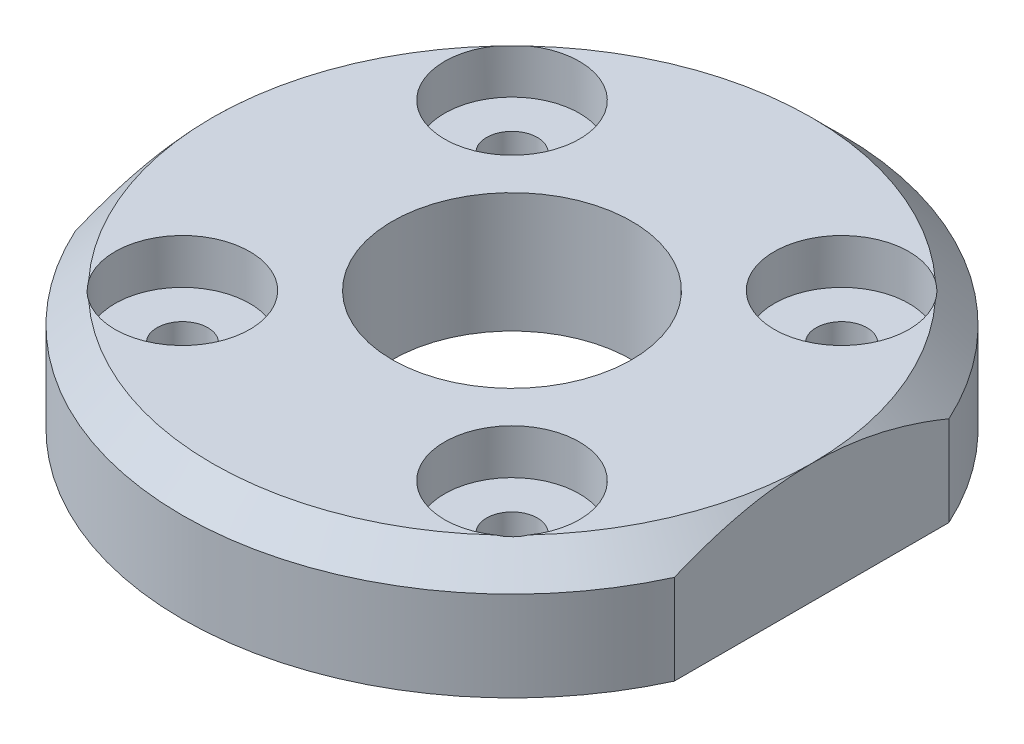
from build123d import *

# Parameters (mm, degrees)
SKETCH1_R                               = 22
SKETCH1_R_2                             = 8
EXTRUDE1_DEPTH                          = 8
CHAMFER1_SIZE                           = 2
CBORE_FOR_M3_HEX_HEAD_BOLT1_D           = 3.4
CBORE_FOR_M3_HEX_HEAD_BOLT1_DEPTH       = 10.1
CBORE_FOR_M3_HEX_HEAD_BOLT1_CBORE_D     = 9
CBORE_FOR_M3_HEX_HEAD_BOLT1_CBORE_DEPTH = 3
CBORE_FOR_M3_HEX_HEAD_BOLT1_TIP         = 1.021463052
SKETCH4_OUTSIDE_W                       = 58.548
SKETCH4_OUTSIDE_H                       = 58.548
SKETCH4_OUTSIDE_W_2                     = 40
SKETCH4_OUTSIDE_H_2                     = 54.265232974
EXTRUDE2_DEPTH                          = 30


with BuildPart() as part:
    # Sketch1 → Extrude1 (new body)
    with BuildSketch(Plane(origin=(0, 0, 0), x_dir=(1, 0, 0), z_dir=(0, 1, 0))):
        with Locations(Location((0, 0, 0), (0, 0, 270))):
            Circle(SKETCH1_R)
        with Locations(Location((0, 0, 0), (0, 0, 270))):
            Circle(SKETCH1_R_2, mode=Mode.SUBTRACT)
    extrude(amount=EXTRUDE1_DEPTH)

    # Chamfer1
    chamfer1_edges = [part.edges().sort_by_distance(p)[0] for p in [
        (0, 8, -22),
    ]]
    chamfer(chamfer1_edges, length=CHAMFER1_SIZE)

    # CBORE for M3 Hex Head Bolt1
    with Locations(Plane(origin=(-11, 8, -11), x_dir=(0, 0, 1), z_dir=(0, 1, 0))):
        with Locations((0, 0), (0, 22), (22, 22), (22, 0)):
            CounterBoreHole(CBORE_FOR_M3_HEX_HEAD_BOLT1_D / 2, CBORE_FOR_M3_HEX_HEAD_BOLT1_CBORE_D / 2, CBORE_FOR_M3_HEX_HEAD_BOLT1_CBORE_DEPTH, depth=CBORE_FOR_M3_HEX_HEAD_BOLT1_DEPTH)
            with Locations((0, 0, -(CBORE_FOR_M3_HEX_HEAD_BOLT1_DEPTH + CBORE_FOR_M3_HEX_HEAD_BOLT1_TIP / 2))):  # 118° drill point
                Cone(0, CBORE_FOR_M3_HEX_HEAD_BOLT1_D / 2, CBORE_FOR_M3_HEX_HEAD_BOLT1_TIP, mode=Mode.SUBTRACT)

    # Sketch4 outside → Extrude2 (cut)
    with BuildSketch(Plane.XZ):
        Rectangle(SKETCH4_OUTSIDE_W, SKETCH4_OUTSIDE_H)
        Rectangle(SKETCH4_OUTSIDE_W_2, SKETCH4_OUTSIDE_H_2, mode=Mode.SUBTRACT)
    extrude(amount=-EXTRUDE2_DEPTH, mode=Mode.SUBTRACT)


solid = part.part
